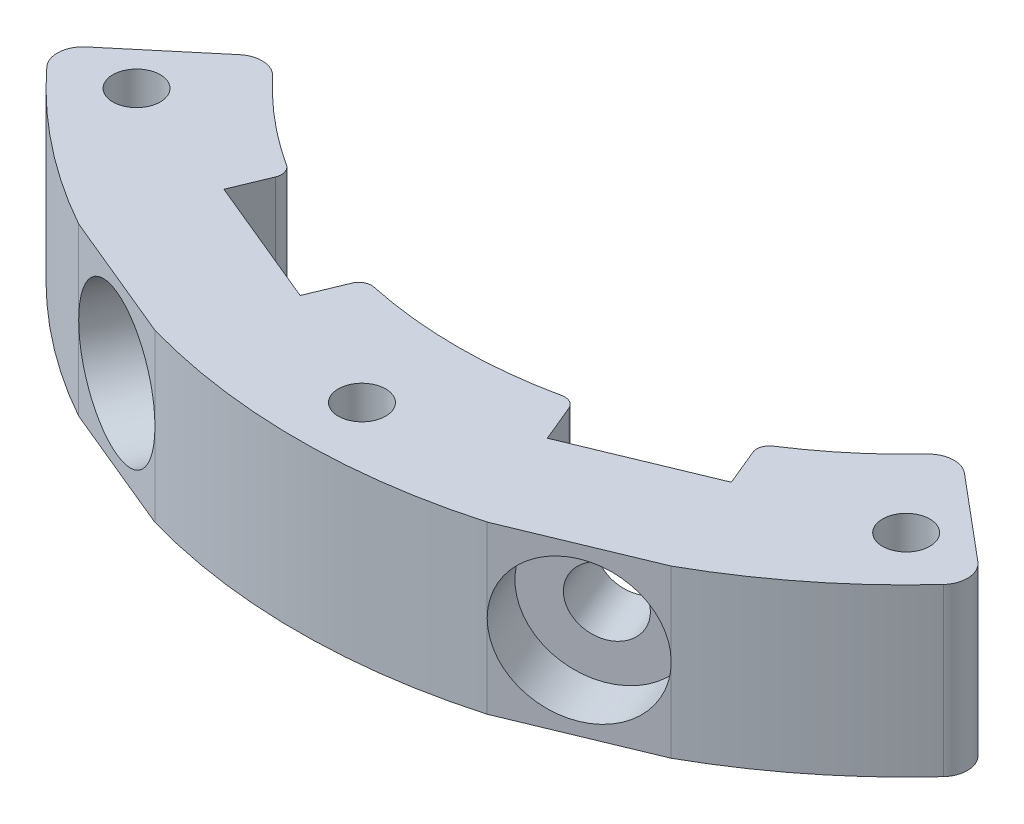
from build123d import *

# Parameters (mm, degrees)
SKETCH_1_R          = 1.85
EXTRUDE_1_DEPTH     = 13
SKETCH_2_R          = 2.6
CUT_EXTRUDE_1_DEPTH = 10
SKETCH_3_R          = 2.6
CUT_EXTRUDE_2_DEPTH = 10
FILLET_1_R          = 2
FILLET_2_R          = 1
SKETCH_4_R          = 3.5
SKETCH_4_R_2        = 1.85
CUT_EXTRUDE_3_DEPTH = 7
CUT_EXTRUDE_5_DEPTH = 61.729236251
CUT_EXTRUDE_START   = -4
SKETCH_6_R          = 5.5
SKETCH_6_R_2        = 2.6
CUT_EXTRUDE_6_DEPTH = 4
SKETCH_7_R          = 5.5
SKETCH_7_R_2        = 2.6
CUT_EXTRUDE_7_DEPTH = 4


with BuildPart() as part:
    # 草图1 → 凸台-拉伸1 (new body)
    with BuildSketch(Plane(origin=(0, 0, 0), x_dir=(1, 0, 0), z_dir=(0, 1, 0))):
        with BuildLine():
            ThreePointArc((-18.308849916, -29.829281164), (-22.856098901, -26.50657924), (-26.811555509, -22.497566339))
            Line((-26.811555509, -22.497566339), (-36.387111048, -30.53241146))
            ThreePointArc((-36.387111048, -30.53241146), (0, -47.5), (36.387111048, -30.53241146))
            Line((36.387111048, -30.53241146), (26.811555509, -22.497566339))
            ThreePointArc((26.811555509, -22.497566339), (22.856098901, -26.50657924), (18.308849916, -29.829281164))
            Line((18.308849916, -29.829281164), (19.814649575, -33.464603124))
            Line((19.814649575, -33.464603124), (9.651974717, -37.67412088))
            Line((9.651974717, -37.67412088), (8.146175058, -34.03879892))
            ThreePointArc((8.146175058, -34.03879892), (0, -35), (-8.146175058, -34.03879892))
            Line((-8.146175058, -34.03879892), (-9.651974717, -37.67412088))
            Line((-9.651974717, -37.67412088), (-19.814649575, -33.464603124))
            Line((-19.814649575, -33.464603124), (-18.308849916, -29.829281164))
        make_face()
        with BuildLine():
            ThreePointArc((-28.2020382, -30.0520382), (-28.237585432, -30.412955296), (-28.342861065, -30.76000255))
            ThreePointArc((-28.342861065, -30.76000255), (-31.866490969, -29.691121105), (-28.2020382, -30.0520382))
        make_face(mode=Mode.SUBTRACT)
        with BuildLine():
            ThreePointArc((1.85, -42.5), (-0.360917096, -44.314452769), (-1.709177135, -41.79203565))
            ThreePointArc((-1.709177135, -41.79203565), (0.360917096, -40.685547231), (1.85, -42.5))
        make_face(mode=Mode.SUBTRACT)
        with Locations(Location((30.0520382, -30.0520382, 0), (0, 0, 90))):
            Circle(SKETCH_1_R, mode=Mode.SUBTRACT)
    extrude(amount=EXTRUDE_1_DEPTH)

    # 草图2 → 切除-拉伸1 (cut)
    with BuildSketch(Plane(origin=(-14.733312146, 0, 35.569362002), x_dir=(-0.9238795325112864, 0, -0.38268343236509067), z_dir=(0.38268343236509067, 0, -0.9238795325112864))):
        with Locations((0, 6.5)):
            Circle(SKETCH_2_R)
    extrude(amount=-CUT_EXTRUDE_1_DEPTH, mode=Mode.SUBTRACT)

    # 草图3 → 切除-拉伸2 (cut)
    with BuildSketch(Plane(origin=(14.733312146, 0, 35.569362002), x_dir=(-0.9238795325112864, 0, 0.38268343236509067), z_dir=(-0.38268343236509067, 0, -0.9238795325112864))):
        with Locations((0, 6.5)):
            Circle(SKETCH_3_R)
    extrude(amount=-CUT_EXTRUDE_2_DEPTH, mode=Mode.SUBTRACT)

    # 圆角1
    fillet_1_edges = [part.edges().sort_by_distance(p)[0] for p in [
        (-26.811555509, 6.5, 22.497566339),
        (26.811555509, 6.5, 22.497566339),
        (36.387111048, 6.5, 30.53241146),
        (-36.387111048, 6.5, 30.53241146),
    ]]
    fillet(fillet_1_edges, radius=FILLET_1_R)

    # 圆角2
    fillet_2_edges = [part.edges().sort_by_distance(p)[0] for p in [
        (-18.308849916, 6.5, 29.829281164),
        (-8.146175058, 6.5, 34.03879892),
        (8.146175058, 6.5, 34.03879892),
        (18.308849916, 6.5, 29.829281164),
    ]]
    fillet(fillet_2_edges, radius=FILLET_2_R)

    # 草图4 → 切除-拉伸3 (cut)
    # profile 1 of 3: a face of its own
    with BuildSketch(Plane.XZ):
        with Locations(Location((-30.0520382, 30.0520382, 0), (0, 0, 270))):
            Circle(SKETCH_4_R)
        with Locations(Location((-30.0520382, 30.0520382, 0), (0, 0, 270))):
            Circle(SKETCH_4_R_2, mode=Mode.SUBTRACT)
    # profile 2 of 3: a face of its own
    with BuildSketch(Plane.XZ):
        with Locations(Location((0, 42.5, 0), (0, 0, 270))):
            Circle(SKETCH_4_R)
        with Locations(Location((0, 42.5, 0), (0, 0, 270))):
            Circle(SKETCH_4_R_2, mode=Mode.SUBTRACT)
    # profile 3 of 3: a face of its own
    with BuildSketch(Plane.XZ):
        with Locations(Location((30.0520382, 30.0520382, 0), (0, 0, 270))):
            Circle(SKETCH_4_R)
        with Locations(Location((30.0520382, 30.0520382, 0), (0, 0, 270))):
            Circle(SKETCH_4_R_2, mode=Mode.SUBTRACT)
    extrude(amount=-CUT_EXTRUDE_3_DEPTH, mode=Mode.SUBTRACT)

    # 草图5 → 切除-拉伸5 (cut, through all)
    with BuildSketch(Plane.XZ):
        with BuildLine():
            Line((-23.136534812, 41.484343515), (-18.055197383, 43.589102393))
            Line((-18.055197383, 43.589102393), (-18.177463037, 43.884277794))
            ThreePointArc((-18.177463037, 43.884277794), (-20.691822677, 42.756268246), (-23.136534812, 41.484343515))
        make_face()
        with BuildLine():
            Line((-18.177463037, 43.884277794), (-18.055197383, 43.589102393))
            Line((-18.055197383, 43.589102393), (-12.973859954, 45.693861271))
            ThreePointArc((-12.973859954, 45.693861271), (-15.601919085, 44.864575345), (-18.177463037, 43.884277794))
        make_face()
        with BuildLine():
            ThreePointArc((18.177463037, 43.884277794), (15.601919085, 44.864575345), (12.973859954, 45.693861271))
            Line((12.973859954, 45.693861271), (18.055197383, 43.589102393))
            Line((18.055197383, 43.589102393), (18.177463037, 43.884277794))
        make_face()
        with BuildLine():
            Line((18.177463037, 43.884277794), (18.055197383, 43.589102393))
            Line((18.055197383, 43.589102393), (23.136534812, 41.484343515))
            ThreePointArc((23.136534812, 41.484343515), (20.691822677, 42.756268246), (18.177463037, 43.884277794))
        make_face()
    extrude(amount=-CUT_EXTRUDE_5_DEPTH, mode=Mode.SUBTRACT)

    # 草图6 → 切除-拉伸6 (cut)
    with BuildSketch(Plane(origin=(-18.055197383, 0, 43.589102393), x_dir=(0.9238795325112865, 0, 0.38268343236509045), z_dir=(-0.38268343236509045, 0, 0.9238795325112865)).offset(CUT_EXTRUDE_START)):
        with Locations((0, 6.5)):
            Circle(SKETCH_6_R)
        with Locations(Location((0, 6.5, 0), (0, 0, 180))):
            Circle(SKETCH_6_R_2, mode=Mode.SUBTRACT)
    extrude(amount=CUT_EXTRUDE_6_DEPTH, mode=Mode.SUBTRACT)

    # 草图7 → 切除-拉伸7 (cut)
    with BuildSketch(Plane(origin=(18.055197383, 0, 43.589102393), x_dir=(0.9238795325112865, 0, -0.38268343236509045), z_dir=(0.38268343236509045, 0, 0.9238795325112865)).offset(CUT_EXTRUDE_START)):
        with Locations((0, 6.5)):
            Circle(SKETCH_7_R)
        with Locations(Location((0, 6.5, 0), (0, 0, 180))):
            Circle(SKETCH_7_R_2, mode=Mode.SUBTRACT)
    extrude(amount=CUT_EXTRUDE_7_DEPTH, mode=Mode.SUBTRACT)


solid = part.part
